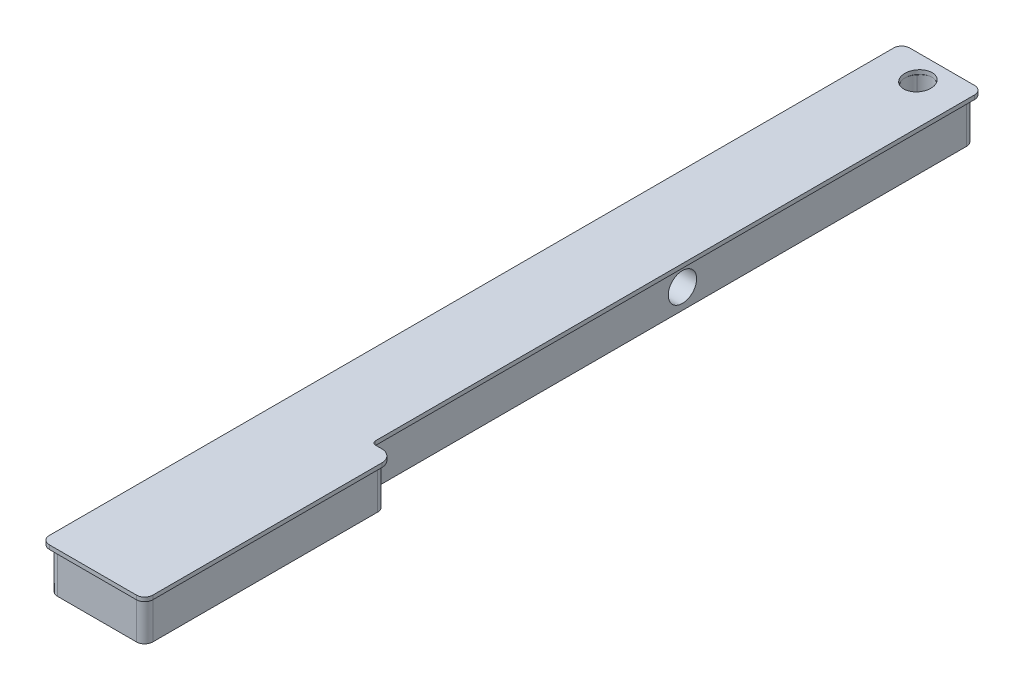
from build123d import *
from build123d.topology import SkipClean

# Parameters (mm, degrees)
BOSS_EXTRU_1_DEPTH      = 10
ESQUISSE2_R             = 3.5
ENL_V_MAT_EXTRU_1_DEPTH = 74
ESQUISSE3_RX            = 3.5
ESQUISSE3_RY            = 3
ENL_V_MAT_EXTRU_2_DEPTH = 10
ESQUISSE4_R             = 3.2
ENL_V_MAT_EXTRU_3_DEPTH = 10
CONG_1_R                = 2
ESQUISSE5_W             = 25.48
ESQUISSE5_H             = 212
BOSS_EXTRU_2_DEPTH      = 1
CONG_2_R                = 2
ENL_V_MAT_EXTRU_4_DEPTH = 1.5
CONG_3_R                = 2
ENL_V_START             = -15
ESQUISSE9_R             = 3.2
ENL_V_MAT_EXTRU_7_DEPTH = 15
ESQUISSE11_RX           = 3.5
ESQUISSE11_RY           = 3.2
ENL_V_MAT_EXTRU_8_DEPTH = 15


with BuildPart() as part:
    # Esquisse1 → Boss.-Extru.1 (new body)
    with BuildSketch(Plane(origin=(0, 0, 0), x_dir=(1, 0, 0), z_dir=(0, 1, 0))):
        Polygon((-11.346248362, 33), (-11.346248362, -105), (12.133751638, -105), (12.133751638, -45.565866313), (6.635965382, -45.565866313), (6.635965382, -45.003296656), (6.635965382, 33), (6.635965382, 105), (-11.346248362, 105), align=None)
    extrude(amount=BOSS_EXTRU_1_DEPTH)

    # Esquisse2 → Enlèv. mat.-Extru.1 (cut)
    with BuildSketch(Plane(origin=(6.635965382, 0, 0), x_dir=(0, 0, -1), z_dir=(1, 0, 0))):
        with Locations((33, 5)):
            Circle(ESQUISSE2_R)
    extrude(amount=-ENL_V_MAT_EXTRU_1_DEPTH, mode=Mode.SUBTRACT)

    # Esquisse3 → Enlèv. mat.-Extru.2 (cut)
    with BuildSketch(Plane(origin=(0, 10, 0), x_dir=(1, 0, 0), z_dir=(0, 1, 0))):
        with Locations(Location((-2.351857607, 100), (0, 0, 90))):
            Ellipse(ESQUISSE3_RX, ESQUISSE3_RY)
    extrude(amount=-ENL_V_MAT_EXTRU_2_DEPTH, mode=Mode.SUBTRACT)

    # Esquisse4 → Enlèv. mat.-Extru.3 (cut)
    with BuildSketch(Plane(origin=(0, 10, 0), x_dir=(1, 0, 0), z_dir=(0, 1, 0))):
        with Locations((-2.351857607, 100)):
            Circle(ESQUISSE4_R)
    extrude(amount=-ENL_V_MAT_EXTRU_3_DEPTH, mode=Mode.SUBTRACT)

    # Congé1
    cong_1_edges = [part.edges().sort_by_distance(p)[0] for p in [
        (-11.346248362, 5, -105),
        (6.635965382, 5, -105),
        (6.635965382, 5, 45.565866313),
        (12.133751638, 5, 45.565866313),
        (12.133751638, 5, 105),
        (-11.346248362, 5, 105),
    ]]
    fillet(cong_1_edges, radius=CONG_1_R)

    # Esquisse5 → Boss.-Extru.2 (add)
    with BuildSketch(Plane(origin=(0, 10, 0), x_dir=(1, 0, 0), z_dir=(0, 1, 0))):
        with Locations((0.393751638, 0)):
            Rectangle(ESQUISSE5_W, ESQUISSE5_H)
    extrude(amount=BOSS_EXTRU_2_DEPTH)

    # Congé2
    cong_2_edges = [part.edges().sort_by_distance(p)[0] for p in [
        (-12.346248362, 10.5, -106),
        (-12.346248362, 10.5, 106),
        (13.133751638, 10.5, 106),
        (13.133751638, 10.5, -106),
    ]]
    fillet(cong_2_edges, radius=CONG_2_R)

    # Esquisse6 → Enlèv. mat.-Extru.4 (cut)
    with BuildSketch(Plane(origin=(0, 10, 0), x_dir=(-1, 0, 0), z_dir=(0, -1, 0))):
        with BuildLine():
            Line((-7.635965382, -43.565866313), (-7.635965382, 107.135147465))
            Line((-7.635965382, 107.135147465), (-14.314001159, 107.135147465))
            Line((-14.314001159, 107.135147465), (-14.314001159, -43.565866313))
            Line((-14.314001159, -43.565866313), (-13.133751638, -47.565866313))
            ThreePointArc((-13.133751638, -47.565866313), (-12.255071982, -45.44454597), (-10.133751638, -44.565866313))
            Line((-10.133751638, -44.565866313), (-8.635965382, -44.565866313))
            ThreePointArc((-8.635965382, -44.565866313), (-7.928858601, -44.272973094), (-7.635965382, -43.565866313))
        make_face()
    extrude(amount=-ENL_V_MAT_EXTRU_4_DEPTH, mode=Mode.SUBTRACT)

    # Congé3
    cong_3_edges = [part.edges().sort_by_distance(p)[0] for p in [
        (7.635965382, 10.5, -106),
    ]]
    fillet(cong_3_edges, radius=CONG_3_R)

    # Esquisse9 → Enlèv. mat.-Extru.7 (cut)
    with SkipClean():  # the faces are left unmerged after this step: merging them gives an invalid solid
        with BuildSketch(Plane.XZ.offset(ENL_V_START)):
            with Locations(Location((-2.351857607, -100, 0), (0, 0, 137.49953069))):
                Circle(ESQUISSE9_R)
        extrude(amount=ENL_V_MAT_EXTRU_7_DEPTH, mode=Mode.SUBTRACT)

    # Esquisse11 → Enlèv. mat.-Extru.8 (cut)
    with BuildSketch(Plane(origin=(0, 10, 0), x_dir=(-1, 0, 0), z_dir=(0, -1, 0))):
        with Locations(Location((2.351857607, 100), (0, 0, -90))):
            Ellipse(ESQUISSE11_RX, ESQUISSE11_RY)
    extrude(amount=-ENL_V_MAT_EXTRU_8_DEPTH, mode=Mode.SUBTRACT)


solid = part.part
